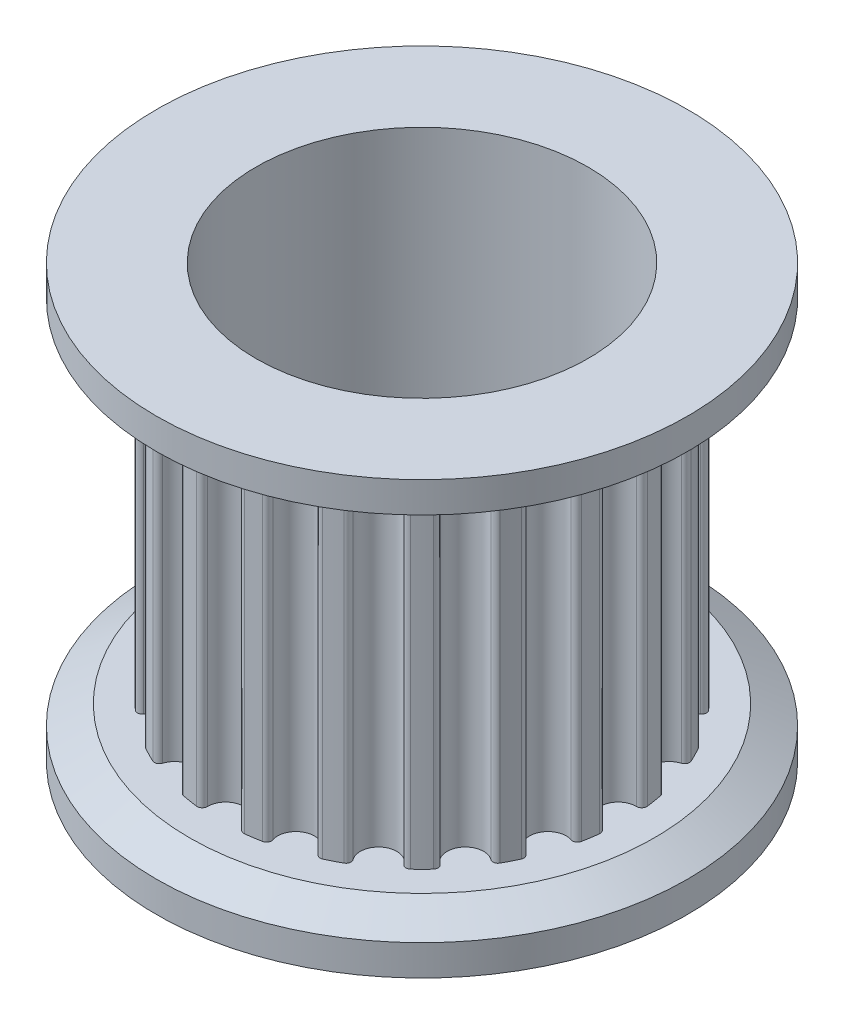
from build123d import *
from OCP.BRepFilletAPI import BRepFilletAPI_MakeChamfer

# Parameters (mm, degrees)
SKETCH_1_R          = 8
SKETCH_1_R_2        = 5
EXTRUDE_1_DEPTH     = 7.45
SKETCH_2_R          = 5
EXTRUDE_2_DEPTH     = 10
SKETCH_3_R          = 8
SKETCH_3_R_2        = 5
EXTRUDE_3_DEPTH     = 1.5
CHAMFER_1_SIZE      = 1
CHAMFER_1_SIZE2     = 0.577350269
SKETCH_1_2_R        = 8
CUT_EXTRUDE_1_DEPTH = 5.95


with BuildPart() as part:
    # Sketch 1 → Бобышка-Вытянуть1 (new body)
    with BuildSketch(Plane(origin=(0, 0, 0), x_dir=(1, 0, 0), z_dir=(0, 1, 0))):
        with Locations(Location((0, 0, 0), (0, 0, 270))):
            Circle(SKETCH_1_R)
        with Locations(Location((0, 0, 0), (0, 0, 270))):
            Circle(SKETCH_1_R_2, mode=Mode.SUBTRACT)
    extrude(amount=EXTRUDE_1_DEPTH)

    # Эскиз2 → Бобышка-Вытянуть2 (add)
    with BuildSketch(Plane(origin=(0, 7.45, 0), x_dir=(1, 0, 0), z_dir=(0, 1, 0))):
        with BuildLine():
            ThreePointArc((-2.557469435, 5.549004423), (-2.773881953, 5.444049863), (-2.985996064, 5.3306592))
            ThreePointArc((-2.985996064, 5.3306592), (-3.059404709, 5.231014138), (-3.032930262, 5.110113057))
            ThreePointArc((-3.032930262, 5.110113057), (-3.150528952, 4.33633109), (-3.922779328, 4.463599867))
            ThreePointArc((-3.922779328, 4.463599867), (-4.029582035, 4.526139051), (-4.14703464, 4.487115298))
            ThreePointArc((-4.14703464, 4.487115298), (-4.320422433, 4.320422433), (-4.487115298, 4.14703464))
            ThreePointArc((-4.487115298, 4.14703464), (-4.526139051, 4.029582035), (-4.463599867, 3.922779328))
            ThreePointArc((-4.463599867, 3.922779328), (-4.33633109, 3.150528952), (-5.110113057, 3.032930262))
            ThreePointArc((-5.110113057, 3.032930262), (-5.231014138, 3.059404709), (-5.3306592, 2.985996064))
            ThreePointArc((-5.3306592, 2.985996064), (-5.444049863, 2.773881953), (-5.549004423, 2.557469435))
            ThreePointArc((-5.549004423, 2.557469435), (-5.549823367, 2.433706366), (-5.457341217, 2.351456627))
            ThreePointArc((-5.457341217, 2.351456627), (-5.097662927, 1.65633109), (-5.797233315, 1.305376312))
            ThreePointArc((-5.797233315, 1.305376312), (-5.92039813, 1.293194518), (-5.992481697, 1.19258673))
            ThreePointArc((-5.992481697, 1.19258673), (-6.034775761, 0.955814581), (-6.067718334, 0.717561302))
            ThreePointArc((-6.067718334, 0.717561302), (-6.030252304, 0.599602562), (-5.916879985, 0.549956967))
            ThreePointArc((-5.916879985, 0.549956967), (-5.36, 0), (-5.916879985, -0.549956967))
            ThreePointArc((-5.916879985, -0.549956967), (-6.030252304, -0.599602562), (-6.067718334, -0.717561302))
            ThreePointArc((-6.067718334, -0.717561302), (-6.034775761, -0.955814581), (-5.992481697, -1.19258673))
            ThreePointArc((-5.992481697, -1.19258673), (-5.92039813, -1.293194518), (-5.797233315, -1.305376312))
            ThreePointArc((-5.797233315, -1.305376312), (-5.097662927, -1.65633109), (-5.457341217, -2.351456627))
            ThreePointArc((-5.457341217, -2.351456627), (-5.549823367, -2.433706366), (-5.549004423, -2.557469435))
            ThreePointArc((-5.549004423, -2.557469435), (-5.444049863, -2.773881953), (-5.3306592, -2.985996064))
            ThreePointArc((-5.3306592, -2.985996064), (-5.231014138, -3.059404709), (-5.110113057, -3.032930262))
            ThreePointArc((-5.110113057, -3.032930262), (-4.33633109, -3.150528952), (-4.463599867, -3.922779328))
            ThreePointArc((-4.463599867, -3.922779328), (-4.526139051, -4.029582035), (-4.487115298, -4.14703464))
            ThreePointArc((-4.487115298, -4.14703464), (-4.320422433, -4.320422433), (-4.14703464, -4.487115298))
            ThreePointArc((-4.14703464, -4.487115298), (-4.029582035, -4.526139051), (-3.922779328, -4.463599867))
            ThreePointArc((-3.922779328, -4.463599867), (-3.150528952, -4.33633109), (-3.032930262, -5.110113057))
            ThreePointArc((-3.032930262, -5.110113057), (-3.059404709, -5.231014138), (-2.985996064, -5.3306592))
            ThreePointArc((-2.985996064, -5.3306592), (-2.773881953, -5.444049863), (-2.557469435, -5.549004423))
            ThreePointArc((-2.557469435, -5.549004423), (-2.433706366, -5.549823367), (-2.351456627, -5.457341217))
            ThreePointArc((-2.351456627, -5.457341217), (-1.65633109, -5.097662927), (-1.305376312, -5.797233315))
            ThreePointArc((-1.305376312, -5.797233315), (-1.293194518, -5.92039813), (-1.19258673, -5.992481697))
            ThreePointArc((-1.19258673, -5.992481697), (-0.955814581, -6.034775761), (-0.717561302, -6.067718334))
            ThreePointArc((-0.717561302, -6.067718334), (-0.599602562, -6.030252304), (-0.549956967, -5.916879985))
            ThreePointArc((-0.549956967, -5.916879985), (0, -5.36), (0.549956967, -5.916879985))
            ThreePointArc((0.549956967, -5.916879985), (0.599602562, -6.030252304), (0.717561302, -6.067718334))
            ThreePointArc((0.717561302, -6.067718334), (0.955814581, -6.034775761), (1.19258673, -5.992481697))
            ThreePointArc((1.19258673, -5.992481697), (1.293194518, -5.92039813), (1.305376312, -5.797233315))
            ThreePointArc((1.305376312, -5.797233315), (1.65633109, -5.097662927), (2.351456627, -5.457341217))
            ThreePointArc((2.351456627, -5.457341217), (2.433706366, -5.549823367), (2.557469435, -5.549004423))
            ThreePointArc((2.557469435, -5.549004423), (2.773881953, -5.444049863), (2.985996064, -5.3306592))
            ThreePointArc((2.985996064, -5.3306592), (3.059404709, -5.231014138), (3.032930262, -5.110113057))
            ThreePointArc((3.032930262, -5.110113057), (3.150528952, -4.33633109), (3.922779328, -4.463599867))
            ThreePointArc((3.922779328, -4.463599867), (4.029582035, -4.526139051), (4.14703464, -4.487115298))
            ThreePointArc((4.14703464, -4.487115298), (4.320422433, -4.320422433), (4.487115298, -4.14703464))
            ThreePointArc((4.487115298, -4.14703464), (4.526139051, -4.029582035), (4.463599867, -3.922779328))
            ThreePointArc((4.463599867, -3.922779328), (4.33633109, -3.150528952), (5.110113057, -3.032930262))
            ThreePointArc((5.110113057, -3.032930262), (5.231014138, -3.059404709), (5.3306592, -2.985996064))
            ThreePointArc((5.3306592, -2.985996064), (5.444049863, -2.773881953), (5.549004423, -2.557469435))
            ThreePointArc((5.549004423, -2.557469435), (5.549823367, -2.433706366), (5.457341217, -2.351456627))
            ThreePointArc((5.457341217, -2.351456627), (5.097662927, -1.65633109), (5.797233315, -1.305376312))
            ThreePointArc((5.797233315, -1.305376312), (5.92039813, -1.293194518), (5.992481697, -1.19258673))
            ThreePointArc((5.992481697, -1.19258673), (6.034775761, -0.955814581), (6.067718334, -0.717561302))
            ThreePointArc((6.067718334, -0.717561302), (6.030252304, -0.599602562), (5.916879985, -0.549956967))
            ThreePointArc((5.916879985, -0.549956967), (5.36, 0), (5.916879985, 0.549956967))
            ThreePointArc((5.916879985, 0.549956967), (6.030252304, 0.599602562), (6.067718334, 0.717561302))
            ThreePointArc((6.067718334, 0.717561302), (6.034775761, 0.955814581), (5.992481697, 1.19258673))
            ThreePointArc((5.992481697, 1.19258673), (5.92039813, 1.293194518), (5.797233315, 1.305376312))
            ThreePointArc((5.797233315, 1.305376312), (5.097662927, 1.65633109), (5.457341217, 2.351456627))
            ThreePointArc((5.457341217, 2.351456627), (5.549823367, 2.433706366), (5.549004423, 2.557469435))
            ThreePointArc((5.549004423, 2.557469435), (5.444049863, 2.773881953), (5.3306592, 2.985996064))
            ThreePointArc((5.3306592, 2.985996064), (5.231014138, 3.059404709), (5.110113057, 3.032930262))
            ThreePointArc((5.110113057, 3.032930262), (4.33633109, 3.150528952), (4.463599867, 3.922779328))
            ThreePointArc((4.463599867, 3.922779328), (4.526139051, 4.029582035), (4.487115298, 4.14703464))
            ThreePointArc((4.487115298, 4.14703464), (4.320422433, 4.320422433), (4.14703464, 4.487115298))
            ThreePointArc((4.14703464, 4.487115298), (4.029582035, 4.526139051), (3.922779328, 4.463599867))
            ThreePointArc((3.922779328, 4.463599867), (3.150528952, 4.33633109), (3.032930262, 5.110113057))
            ThreePointArc((3.032930262, 5.110113057), (3.059404709, 5.231014138), (2.985996064, 5.3306592))
            ThreePointArc((2.985996064, 5.3306592), (2.773881953, 5.444049863), (2.557469435, 5.549004423))
            ThreePointArc((2.557469435, 5.549004423), (2.433706366, 5.549823367), (2.351456627, 5.457341217))
            ThreePointArc((2.351456627, 5.457341217), (1.65633109, 5.097662927), (1.305376312, 5.797233315))
            ThreePointArc((1.305376312, 5.797233315), (1.293194518, 5.92039813), (1.19258673, 5.992481697))
            ThreePointArc((1.19258673, 5.992481697), (0.955814581, 6.034775761), (0.717561302, 6.067718334))
            ThreePointArc((0.717561302, 6.067718334), (0.599602562, 6.030252304), (0.549956967, 5.916879985))
            ThreePointArc((0.549956967, 5.916879985), (0, 5.36), (-0.549956967, 5.916879985))
            ThreePointArc((-0.549956967, 5.916879985), (-0.599602562, 6.030252304), (-0.717561302, 6.067718334))
            ThreePointArc((-0.717561302, 6.067718334), (-0.955814581, 6.034775761), (-1.19258673, 5.992481697))
            ThreePointArc((-1.19258673, 5.992481697), (-1.293194518, 5.92039813), (-1.305376312, 5.797233315))
            ThreePointArc((-1.305376312, 5.797233315), (-1.65633109, 5.097662927), (-2.351456627, 5.457341217))
            ThreePointArc((-2.351456627, 5.457341217), (-2.433706366, 5.549823367), (-2.557469435, 5.549004423))
        make_face()
        with Locations(Location((0, 0, 0), (0, 0, 270))):
            Circle(SKETCH_2_R, mode=Mode.SUBTRACT)
    extrude(amount=EXTRUDE_2_DEPTH)

    # Эскиз3 → Бобышка-Вытянуть3 (add)
    with BuildSketch(Plane(origin=(0, 17.45, 0), x_dir=(1, 0, 0), z_dir=(0, 1, 0))):
        with Locations(Location((0, 0, 0), (0, 0, 270))):
            Circle(SKETCH_3_R)
        with Locations(Location((0, 0, 0), (0, 0, 270))):
            Circle(SKETCH_3_R_2, mode=Mode.SUBTRACT)
    extrude(amount=EXTRUDE_3_DEPTH)

    # Фаска1: one chamfer whose edges measure the first distance from different faces: ONE call of the kernel's chamfer builder (chamfer() names one face for all edges)
    chamfer_1_edges_1 = [part.edges().sort_by_distance(p)[0] for p in [
        (0, 17.45, -8),
    ]]
    chamfer_1_side_1 = [part.faces().sort_by_distance(p)[0] for p in [
        (0, 17.45, -7.77372583),
    ]]
    chamfer_1_edges_2 = [part.edges().sort_by_distance(p)[0] for p in [
        (0, 7.45, -8),
    ]]
    chamfer_1_side_2 = [part.faces().sort_by_distance(p)[0] for p in [
        (0, 7.45, -7.77372583),
    ]]
    chamfer_1 = BRepFilletAPI_MakeChamfer(part.part.solid().wrapped)
    for e in chamfer_1_edges_1:
        chamfer_1.Add(CHAMFER_1_SIZE, CHAMFER_1_SIZE2, e.wrapped, chamfer_1_side_1[0].wrapped)  # the first distance lies on this face
    for e in chamfer_1_edges_2:
        chamfer_1.Add(CHAMFER_1_SIZE, CHAMFER_1_SIZE2, e.wrapped, chamfer_1_side_2[0].wrapped)  # the first distance lies on this face
    add(Compound.cast(chamfer_1.Shape()), mode=Mode.REPLACE)

    # Sketch 1 2 → 切除-拉伸1 (cut)
    with BuildSketch(Plane.XZ):
        with Locations(Location((0, 0, 0), (0, 0, 270))):
            Circle(SKETCH_1_2_R)
    extrude(amount=-CUT_EXTRUDE_1_DEPTH, mode=Mode.SUBTRACT)


solid = part.part
